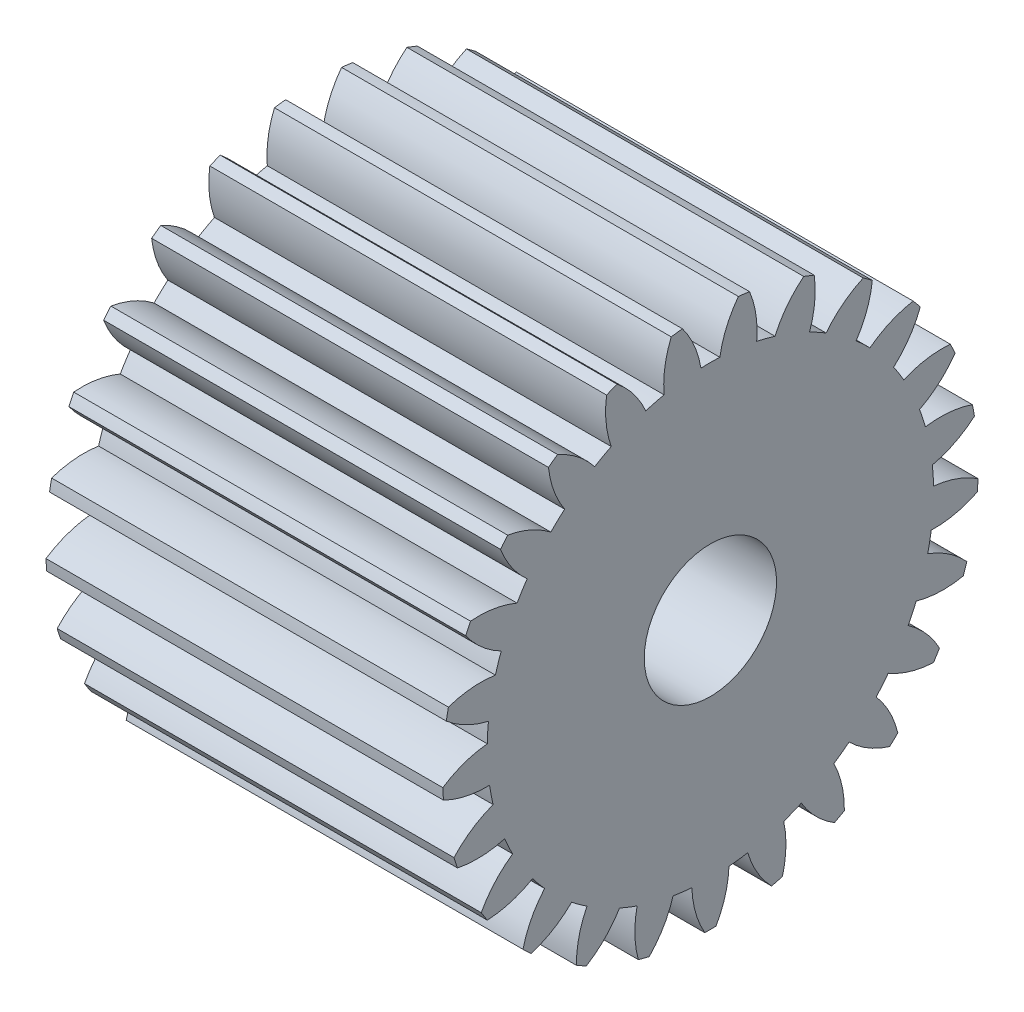
from build123d import *

# Parameters (mm, degrees)
BASPROSKE_W     = 60
BASPROSKE_H     = 40.5
TOOTHCUT_DEPTH  = 83.948779376
TEETHCUTS_COUNT = 25
TEETHCUTS_ANGLE = 345.6
BORSKE_R        = 10
BORE_DEPTH      = 60.0000508


with BuildPart() as part:
    # BasProSke → Base-Revolve (revolve)
    with BuildSketch(Plane(origin=(0, 0, 0), x_dir=(1, 0, 0), z_dir=(0, 1, 0)), mode=Mode.PRIVATE) as base_revolve_sk:
        with Locations((30, 20.25)):
            Rectangle(BASPROSKE_W, BASPROSKE_H)
    revolve(base_revolve_sk.sketch.rotate(Axis((-10, 0, 0), (1, 0, 0)), 180), axis=Axis((-10, 0, 0), (1, 0, 0)))

    # TooCutSke → ToothCut (cut, through all)
    with BuildSketch(Plane(origin=(0, 0, 0), x_dir=(0, 0, -1), z_dir=(1, 0, 0))):
        with BuildLine():
            ThreePointArc((1.429559214, 33.718709368), (0, 33.749), (-1.429559214, 33.718709368))
            ThreePointArc((-1.429559214, 33.718709368), (-2.439903957, 37.181084014), (-4.24753643, 40.302189512))
            ThreePointArc((-4.24753643, 40.302189512), (0, 40.5254), (4.24753643, 40.302189512))
            ThreePointArc((4.24753643, 40.302189512), (2.439903957, 37.181084014), (1.429559214, 33.718709368))
        make_face()
    toothcut = extrude(amount=TOOTHCUT_DEPTH, mode=Mode.SUBTRACT)

    # TeethCuts: ToothCut ×25 about axis
    teethcuts_axis = Axis((-10, 0, 0), (1, 0, 0))
    for i in range(1, TEETHCUTS_COUNT):
        add(toothcut.rotate(teethcuts_axis, i * TEETHCUTS_ANGLE / (TEETHCUTS_COUNT - 1)), mode=Mode.SUBTRACT)

    # BorSke → Bore (cut, symmetric)
    with BuildSketch(Plane(origin=(0, 0, 0), x_dir=(0, 0, -1), z_dir=(1, 0, 0))):
        with Locations(Location((0, 0, 0), (0, 0, 180))):
            Circle(BORSKE_R)
    extrude(amount=BORE_DEPTH, both=True, mode=Mode.SUBTRACT)


solid = part.part
